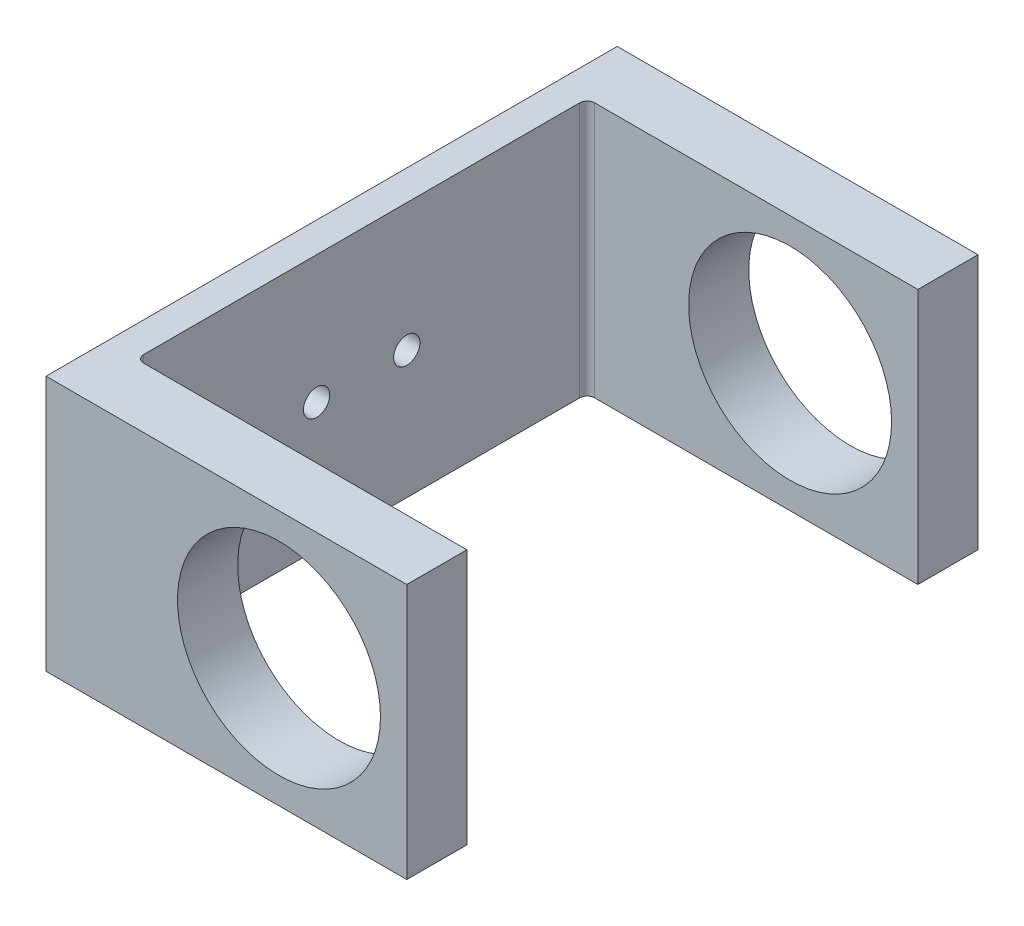
from build123d import *

# Parameters (mm, degrees)
SKETCH1_W           = 60
SKETCH1_H           = 34
SKETCH1_R           = 1.75
BOSS_EXTRUDE1_DEPTH = 4
SKETCH3_W           = 48
SKETCH3_H           = 34
SKETCH3_R           = 13.5
BOSS_EXTRUDE2_DEPTH = 8
FILLET4_R           = 1
FILLET5_R           = 1


with BuildPart() as part:
    # Sketch1 → Boss-Extrude1 (new body)
    with BuildSketch(Plane(origin=(0, 0, 0), x_dir=(0, 0, -1), z_dir=(1, 0, 0))):
        Rectangle(SKETCH1_W, SKETCH1_H)
        with Locations((-6, 0)):
            Circle(SKETCH1_R, mode=Mode.SUBTRACT)
        with Locations(Location((6, 0, 0), (0, 0, 180))):
            Circle(SKETCH1_R, mode=Mode.SUBTRACT)
    extrude(amount=-BOSS_EXTRUDE1_DEPTH)

    # Sketch3 → Boss-Extrude2 (add)
    with BuildSketch(Plane.XY.offset(30)):
        with Locations((20, 0)):
            Rectangle(SKETCH3_W, SKETCH3_H)
        with Locations((27, 0)):
            Circle(SKETCH3_R, mode=Mode.SUBTRACT)
    boss_extrude2 = extrude(amount=BOSS_EXTRUDE2_DEPTH)

    # Mirror1: Boss-Extrude2 across plane
    add(boss_extrude2.mirror(Plane(origin=(0, 0, 0), x_dir=(1, 0, 0), z_dir=(0, 0, -1))))

    # Fillet4
    fillet4_edges = [part.edges().sort_by_distance(p)[0] for p in [
        (0, 0, 30),
    ]]
    fillet(fillet4_edges, radius=FILLET4_R)

    # Fillet5
    fillet5_edges = [part.edges().sort_by_distance(p)[0] for p in [
        (0, 0, -30),
    ]]
    fillet(fillet5_edges, radius=FILLET5_R)


solid = part.part
